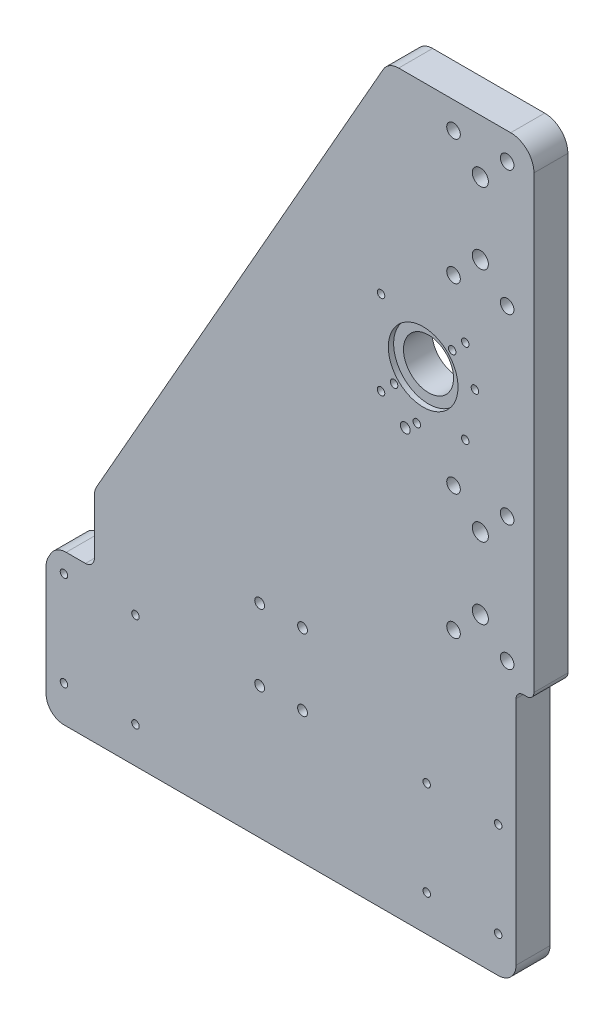
from build123d import *

# Parameters (mm, degrees)
SKETCH2_W               = 270.829085825
SKETCH2_H               = 402
BOSS_EXTRUDE1_DEPTH     = 19
SKETCH3_W               = 7.829085824
SKETCH3_H               = 419.560715459
CUT_EXTRUDE1_DEPTH      = 20
CUT_EXTRUDE2_DEPTH      = 20
FILLET1_R               = 10
TAP_DRILL_FOR_M5_TAP1_D = 4.2
FILLET2_R               = 3
M7_CLEARANCE_HOLE1_D    = 7.6
SKETCH11_R              = 19.5
CUT_EXTRUDE4_DEPTH      = 32.266788686
CUT_EXTRUDE5_DEPTH      = 20
FILLET3_R               = 10
FILLET4_R               = 5
TAP_DRILL_FOR_M5_TAP2_D = 4.2
BOSS_EXTRUDE2_DEPTH     = 19
BOSS_EXTRUDE3_START     = -16
SKETCH16_R              = 19.5
SKETCH16_R_2            = 14
BOSS_EXTRUDE3_DEPTH     = 16
M5_CLEARANCE_HOLE4_D    = 5.5
M5_CLEARANCE_HOLE5_D    = 5.5
M8_CLEARANCE_HOLE1_D    = 9
TAP_DRILL_FOR_M5_TAP3_D = 4.2
CUT_EXTRUDE6_DEPTH      = 4


with BuildPart() as part:
    # Sketch2 → Boss-Extrude1 (new body)
    with BuildSketch(Plane.XY.offset(94)):
        with Locations((2322.392578952, 658.909518743)):
            Rectangle(SKETCH2_W, SKETCH2_H)
    extrude(amount=BOSS_EXTRUDE1_DEPTH)

    # Sketch3 → Cut-Extrude1 (cut)
    with BuildSketch(Plane.XY.offset(113)):
        with Locations((2190.892578951, 654.789569031)):
            Rectangle(SKETCH3_W, SKETCH3_H)
    extrude(amount=-CUT_EXTRUDE1_DEPTH, mode=Mode.SUBTRACT)

    # Sketch4 → Cut-Extrude2 (cut)
    with BuildSketch(Plane.XY.offset(113)):
        Polygon((2194.807121863, 532.656963015), (2380.609228318, 859.909518743), (2194.807121863, 859.909518743), align=None)
    extrude(amount=-CUT_EXTRUDE2_DEPTH, mode=Mode.SUBTRACT)

    # Fillet1
    fillet1_edges = [part.edges().sort_by_distance(p)[0] for p in [
        (2194.807121863, 457.909518743, 103.5),
        (2194.807121863, 532.656963015, 103.5),
        (2380.609228318, 859.909518743, 103.5),
        (2457.807121864, 457.909518743, 103.5),
    ]]
    fillet(fillet1_edges, radius=FILLET1_R)

    # Tap Drill for M5 Tap1 (through all)
    with Locations(Plane.XY.offset(113)):
        with Locations((2338.307121864, 531.660659234), (2314.307121864, 531.660659234), (2314.307121864, 571.660659234), (2338.307121864, 571.660659234), (2447.807121864, 531.160659234), (2447.807121864, 478.160659234), (2407.807121864, 478.160659234), (2407.807121864, 531.160659234), (2244.807121863, 531.160659234), (2244.807121863, 478.160659234), (2204.807121863, 478.160659234), (2204.807121863, 531.160659234)):
            Hole(TAP_DRILL_FOR_M5_TAP1_D / 2)

    # Fillet2
    fillet2_edges = [part.edges().sort_by_distance(p)[0] for p in [
        (2457.807121864, 859.909518743, 103.5),
    ]]
    fillet(fillet2_edges, radius=FILLET2_R)

    # M7 Clearance Hole1 (through all)
    with Locations(Plane.XY.offset(113)):
        with Locations((2422.807121864, 612.909518743), (2437.807121864, 627.909518743), (2452.807121864, 612.909518743), (2452.807121864, 682.909518743), (2437.807121864, 667.909518743), (2422.807121864, 682.909518743), (2452.807121864, 784.909518743), (2422.807121864, 854.909518743), (2452.807121864, 854.909518743), (2422.807121864, 784.909518743), (2437.807121864, 799.909518743), (2437.807121864, 839.909518743)):
            Hole(M7_CLEARANCE_HOLE1_D / 2)

    # Sketch11 → Cut-Extrude4 (cut)
    with BuildSketch(Plane.XY.offset(113)):
        with Locations((2405.807121866, 731.909518744)):
            Circle(SKETCH11_R)
    extrude(amount=-CUT_EXTRUDE4_DEPTH, mode=Mode.SUBTRACT)

    # Sketch12 → Cut-Extrude5 (cut)
    with BuildSketch(Plane.XY.offset(113)):
        Polygon((2221.807121863, 542.160659234), (2189.780449764, 542.160659234), (2221.807121863, 583.425794439), align=None)
    extrude(amount=-CUT_EXTRUDE5_DEPTH, mode=Mode.SUBTRACT)

    # Fillet3
    fillet3_edges = [part.edges().sort_by_distance(p)[0] for p in [
        (2200.202975144, 542.160659234, 103.5),
        (2221.807121863, 580.211962112, 103.5),
    ]]
    fillet(fillet3_edges, radius=FILLET3_R)

    # Fillet4
    fillet4_edges = [part.edges().sort_by_distance(p)[0] for p in [
        (2221.807121863, 542.160659234, 103.5),
    ]]
    fillet(fillet4_edges, radius=FILLET4_R)

    # Tap Drill for M5 Tap2 (through all)
    with Locations(Plane(origin=(0, 0, 94), x_dir=(-1, 0, 0), z_dir=(0, 0, -1))):
        with Locations((-2429.377121866, 755.479518745), (-2382.237121866, 755.479518745), (-2429.377121866, 708.339518745), (-2382.237121866, 708.339518745)):
            Hole(TAP_DRILL_FOR_M5_TAP2_D / 2)

    # Sketch15 → Boss-Extrude2 (add)
    with BuildSketch(Plane.XY.offset(113)):
        with BuildLine():
            Line((2457.807121864, 856.909518743), (2457.807121864, 597.10478226))
            ThreePointArc((2457.807121864, 597.10478226), (2458.978694739, 599.933209385), (2461.807121864, 601.10478226))
            Line((2461.807121864, 601.10478226), (2463.807121864, 601.10478226))
            ThreePointArc((2463.807121864, 601.10478226), (2466.635548988, 602.276355135), (2467.807121864, 605.10478226))
            Line((2467.807121864, 605.10478226), (2467.807121864, 856.909518743))
            ThreePointArc((2467.807121864, 856.909518743), (2463.999510019, 866.101906899), (2454.807121864, 869.909518743))
            Line((2454.807121864, 869.909518743), (2392.108600325, 869.909518743))
            ThreePointArc((2392.108600325, 869.909518743), (2387.077370287, 868.551666874), (2383.412473272, 864.846863605))
            Line((2383.412473272, 864.846863605), (2377.734836743, 854.846863605))
            ThreePointArc((2377.734836743, 854.846863605), (2381.399733758, 858.551666874), (2386.430963796, 859.909518743))
            Line((2386.430963796, 859.909518743), (2454.807121864, 859.909518743))
            ThreePointArc((2454.807121864, 859.909518743), (2456.928442207, 859.030839087), (2457.807121864, 856.909518743))
        make_face()
    extrude(amount=-BOSS_EXTRUDE2_DEPTH)

    # Sketch16 → Boss-Extrude3 (add)
    with BuildSketch(Plane(origin=(0, 0, 94), x_dir=(-1, 0, 0), z_dir=(0, 0, -1)).offset(BOSS_EXTRUDE3_START)):
        with Locations(Location((-2405.807121866, 731.909518744, 0), (0, 0, 180))):
            Circle(SKETCH16_R)
        with Locations((-2405.807121866, 731.909518744)):
            Circle(SKETCH16_R_2, mode=Mode.SUBTRACT)
    extrude(amount=BOSS_EXTRUDE3_DEPTH)

    # M5 Clearance Hole4 (through all)
    with Locations(Plane(origin=(0, 0, 94), x_dir=(-1, 0, 0), z_dir=(0, 0, -1))):
        with Locations((-2395.807121866, 697.409518744)):
            Hole(M5_CLEARANCE_HOLE4_D / 2)

    # M5 Clearance Hole5 (through all)
    with Locations(Plane(origin=(0, 0, 94), x_dir=(-1, 0, 0), z_dir=(0, 0, -1))):
        with Locations((-2338.307121864, 531.660659234), (-2314.307121864, 531.660659234), (-2314.307121864, 571.660659234), (-2338.307121864, 571.660659234)):
            Hole(M5_CLEARANCE_HOLE5_D / 2)

    # M8 Clearance Hole1 (through all)
    with Locations(Plane(origin=(0, 0, 94), x_dir=(-1, 0, 0), z_dir=(0, 0, -1))):
        with Locations((-2437.807121864, 627.909518743), (-2437.807121864, 667.909518743), (-2437.807121864, 799.909518743), (-2437.807121864, 839.909518743)):
            Hole(M8_CLEARANCE_HOLE1_D / 2)

    # Tap Drill for M5 Tap3 (through all)
    with Locations(Plane(origin=(0, 0, 94), x_dir=(-1, 0, 0), z_dir=(0, 0, -1))):
        with Locations((-2422.070577833, 748.172974712), (-2434.798499894, 735.445052651), (-2402.27158796, 702.918140716), (-2389.543665898, 715.646062777)):
            Hole(TAP_DRILL_FOR_M5_TAP3_D / 2)

    # Sketch25 → Cut-Extrude6 (cut)
    with BuildSketch(Plane(origin=(0, 0, 94), x_dir=(-1, 0, 0), z_dir=(0, 0, -1))):
        Polygon((-2430.208565254, 735.445052651), (-2432.503532574, 739.420052651), (-2437.093467214, 739.420052651), (-2439.388434534, 735.445052651), (-2437.093467214, 731.470052651), (-2432.503532574, 731.470052651), align=None)
        Polygon((-2426.660512473, 748.172974712), (-2424.365545153, 744.197974712), (-2419.775610513, 744.197974712), (-2417.480643193, 748.172974712), (-2419.775610513, 752.147974712), (-2424.365545153, 752.147974712), align=None)
        Polygon((-2402.27158796, 707.508075356), (-2406.24658796, 705.213108036), (-2406.24658796, 700.623173396), (-2402.27158796, 698.328206076), (-2398.29658796, 700.623173396), (-2398.29658796, 705.213108036), align=None)
        Polygon((-2389.543665898, 720.235997418), (-2393.518665898, 717.941030098), (-2393.518665898, 713.351095457), (-2389.543665898, 711.056128137), (-2385.568665898, 713.351095457), (-2385.568665898, 717.941030098), align=None)
    extrude(amount=-CUT_EXTRUDE6_DEPTH, mode=Mode.SUBTRACT)


solid = part.part
